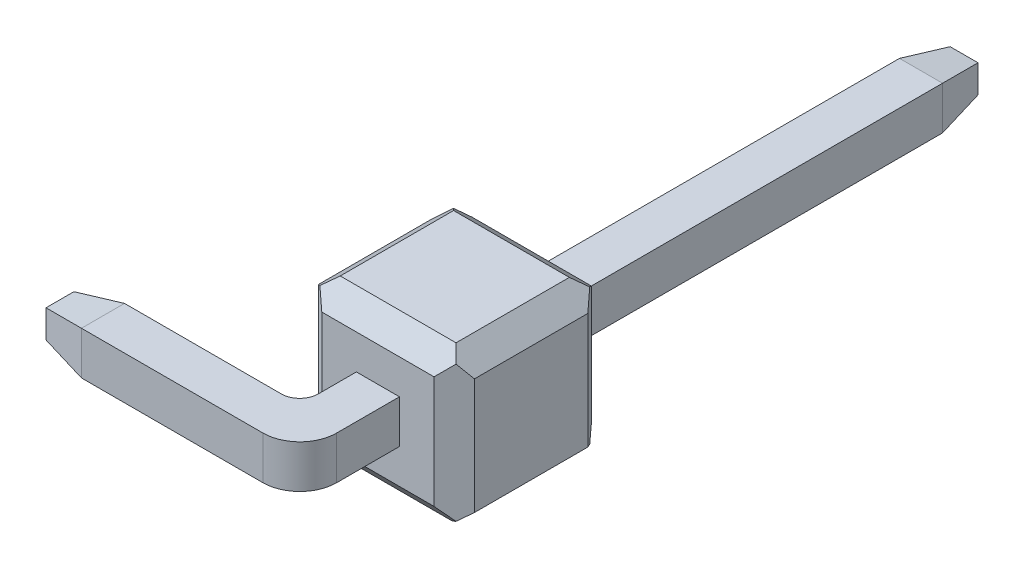
from build123d import *
from OCP.BRepFilletAPI import BRepFilletAPI_MakeChamfer

# Parameters (mm, degrees)
EXTRUDE_1_DEPTH = 0.7
CHAMFER_1_SIZE  = 0.7
CHAMFER_1_SIZE2 = 0.123428886
CHAMFER_2_SIZE  = 0.7
CHAMFER_2_SIZE2 = 0.123428886
SKETCH_2_W      = 2.54
SKETCH_2_H      = 2.54
EXTRUDE_2_DEPTH = 2.5
CHAMFER_3_SIZE  = 0.3
CHAMFER_3_SIZE2 = 0.357526078
CHAMFER_4_SIZE  = 0.3
CHAMFER_4_SIZE2 = 0.357526078
CHAMFER_5_SIZE  = 0.3
CHAMFER_5_SIZE2 = 0.357526078


with BuildPart() as part:
    # Эскиз1 → Бобышка-Вытянуть1 (new body)
    with BuildSketch(Plane(origin=(0, 0, 0), x_dir=(1, 0, 0), z_dir=(0, 1, 0))):
        with BuildLine():
            Line((0.35, 0), (0.35, -10.55))
            ThreePointArc((0.35, -10.55), (0.174264069, -10.974264069), (-0.25, -11.15))
            Line((-0.25, -11.15), (-3.9, -11.15))
            Line((-3.9, -11.15), (-3.9, -10.45))
            Line((-3.9, -10.45), (-0.65, -10.45))
            ThreePointArc((-0.65, -10.45), (-0.437867966, -10.362132034), (-0.35, -10.15))
            Line((-0.35, -10.15), (-0.35, 0))
            Line((-0.35, 0), (0.35, 0))
        make_face()
    extrude(amount=EXTRUDE_1_DEPTH)

    # Фаска1: one chamfer whose edges measure the first distance from different faces: ONE call of the kernel's chamfer builder (chamfer() names one face for all edges)
    chamfer_1_edges_1 = [part.edges().sort_by_distance(p)[0] for p in [
        (0, 0, 0),
    ]]
    chamfer_1_side_1 = [part.faces().sort_by_distance(p)[0] for p in [
        (-0.230674814, 0, 5.075),
    ]]
    chamfer_1_edges_2 = [part.edges().sort_by_distance(p)[0] for p in [
        (0.35, 0.35, 0),
    ]]
    chamfer_1_side_2 = [part.faces().sort_by_distance(p)[0] for p in [
        (0.35, 0.35, 5.275),
    ]]
    chamfer_1_edges_3 = [part.edges().sort_by_distance(p)[0] for p in [
        (-0.35, 0.35, 0),
    ]]
    chamfer_1_side_3 = [part.faces().sort_by_distance(p)[0] for p in [
        (-0.35, 0.35, 5.075),
    ]]
    chamfer_1_edges_4 = [part.edges().sort_by_distance(p)[0] for p in [
        (0, 0.7, 0),
    ]]
    chamfer_1_side_4 = [part.faces().sort_by_distance(p)[0] for p in [
        (-0.230674814, 0.7, 5.075),
    ]]
    chamfer_1 = BRepFilletAPI_MakeChamfer(part.part.solid().wrapped)
    for e in chamfer_1_edges_1:
        chamfer_1.Add(CHAMFER_1_SIZE, CHAMFER_1_SIZE2, e.wrapped, chamfer_1_side_1[0].wrapped)  # the first distance lies on this face
    for e in chamfer_1_edges_2:
        chamfer_1.Add(CHAMFER_1_SIZE, CHAMFER_1_SIZE2, e.wrapped, chamfer_1_side_2[0].wrapped)  # the first distance lies on this face
    for e in chamfer_1_edges_3:
        chamfer_1.Add(CHAMFER_1_SIZE, CHAMFER_1_SIZE2, e.wrapped, chamfer_1_side_3[0].wrapped)  # the first distance lies on this face
    for e in chamfer_1_edges_4:
        chamfer_1.Add(CHAMFER_1_SIZE, CHAMFER_1_SIZE2, e.wrapped, chamfer_1_side_4[0].wrapped)  # the first distance lies on this face
    add(Compound.cast(chamfer_1.Shape()), mode=Mode.REPLACE)

    # Фаска2: one chamfer whose edges measure the first distance from different faces: ONE call of the kernel's chamfer builder (chamfer() names one face for all edges)
    chamfer_2_edges_1 = [part.edges().sort_by_distance(p)[0] for p in [
        (-3.9, 0.35, 11.15),
    ]]
    chamfer_2_side_1 = [part.faces().sort_by_distance(p)[0] for p in [
        (-2.075, 0.35, 11.15),
    ]]
    chamfer_2_edges_2 = [part.edges().sort_by_distance(p)[0] for p in [
        (-3.9, 0.35, 10.45),
    ]]
    chamfer_2_side_2 = [part.faces().sort_by_distance(p)[0] for p in [
        (-2.275, 0.35, 10.45),
    ]]
    chamfer_2_edges_3 = [part.edges().sort_by_distance(p)[0] for p in [
        (-3.9, 0.7, 10.8),
    ]]
    chamfer_2_side_3 = [part.faces().sort_by_distance(p)[0] for p in [
        (-0.23718821, 0.7, 5.425),
    ]]
    chamfer_2_edges_4 = [part.edges().sort_by_distance(p)[0] for p in [
        (-3.9, 0, 10.8),
    ]]
    chamfer_2_side_4 = [part.faces().sort_by_distance(p)[0] for p in [
        (-0.23718821, 0, 5.425),
    ]]
    chamfer_2 = BRepFilletAPI_MakeChamfer(part.part.solid().wrapped)
    for e in chamfer_2_edges_1:
        chamfer_2.Add(CHAMFER_2_SIZE, CHAMFER_2_SIZE2, e.wrapped, chamfer_2_side_1[0].wrapped)  # the first distance lies on this face
    for e in chamfer_2_edges_2:
        chamfer_2.Add(CHAMFER_2_SIZE, CHAMFER_2_SIZE2, e.wrapped, chamfer_2_side_2[0].wrapped)  # the first distance lies on this face
    for e in chamfer_2_edges_3:
        chamfer_2.Add(CHAMFER_2_SIZE, CHAMFER_2_SIZE2, e.wrapped, chamfer_2_side_3[0].wrapped)  # the first distance lies on this face
    for e in chamfer_2_edges_4:
        chamfer_2.Add(CHAMFER_2_SIZE, CHAMFER_2_SIZE2, e.wrapped, chamfer_2_side_4[0].wrapped)  # the first distance lies on this face
    add(Compound.cast(chamfer_2.Shape()), mode=Mode.REPLACE)

    # Эскиз2 → Бобышка-Вытянуть2 (add)
    with BuildSketch(Plane.XY.offset(9.53)):
        with Locations((0, 0.35)):
            Rectangle(SKETCH_2_W, SKETCH_2_H)
    extrude(amount=-EXTRUDE_2_DEPTH)

    # Фаска3
    chamfer_3_edges = [part.edges().sort_by_distance(p)[0] for p in [
        (-1.27, 0.35, 7.03),
        (0, 1.62, 7.03),
        (1.27, 0.35, 7.03),
        (0, -0.92, 7.03),
    ]]
    chamfer_3_side = [part.faces().sort_by_distance(p)[0] for p in [
        (0, -0.884078976, 7.03),
    ]]
    chamfer(chamfer_3_edges, length=CHAMFER_3_SIZE, length2=CHAMFER_3_SIZE2, reference=chamfer_3_side[0])

    # Фаска4: one chamfer whose edges measure the first distance from different faces: ONE call of the kernel's chamfer builder (chamfer() names one face for all edges)
    chamfer_4_edges_1 = [part.edges().sort_by_distance(p)[0] for p in [
        (-1.27, 0.35, 9.53),
    ]]
    chamfer_4_side_1 = [part.faces().sort_by_distance(p)[0] for p in [
        (-1.27, 0.35, 8.458763039),
    ]]
    chamfer_4_edges_2 = [part.edges().sort_by_distance(p)[0] for p in [
        (0, -0.92, 9.53),
    ]]
    chamfer_4_side_2 = [part.faces().sort_by_distance(p)[0] for p in [
        (0, -0.92, 8.458763039),
    ]]
    chamfer_4_edges_3 = [part.edges().sort_by_distance(p)[0] for p in [
        (1.27, 0.35, 9.53),
    ]]
    chamfer_4_side_3 = [part.faces().sort_by_distance(p)[0] for p in [
        (1.27, 0.35, 8.458763039),
    ]]
    chamfer_4_edges_4 = [part.edges().sort_by_distance(p)[0] for p in [
        (0, 1.62, 9.53),
    ]]
    chamfer_4_side_4 = [part.faces().sort_by_distance(p)[0] for p in [
        (0, 1.62, 8.458763039),
    ]]
    chamfer_4 = BRepFilletAPI_MakeChamfer(part.part.solid().wrapped)
    for e in chamfer_4_edges_1:
        chamfer_4.Add(CHAMFER_4_SIZE, CHAMFER_4_SIZE2, e.wrapped, chamfer_4_side_1[0].wrapped)  # the first distance lies on this face
    for e in chamfer_4_edges_2:
        chamfer_4.Add(CHAMFER_4_SIZE, CHAMFER_4_SIZE2, e.wrapped, chamfer_4_side_2[0].wrapped)  # the first distance lies on this face
    for e in chamfer_4_edges_3:
        chamfer_4.Add(CHAMFER_4_SIZE, CHAMFER_4_SIZE2, e.wrapped, chamfer_4_side_3[0].wrapped)  # the first distance lies on this face
    for e in chamfer_4_edges_4:
        chamfer_4.Add(CHAMFER_4_SIZE, CHAMFER_4_SIZE2, e.wrapped, chamfer_4_side_4[0].wrapped)  # the first distance lies on this face
    add(Compound.cast(chamfer_4.Shape()), mode=Mode.REPLACE)

    # Фаска5: one chamfer whose edges measure the first distance from different faces: ONE call of the kernel's chamfer builder (chamfer() names one face for all edges)
    chamfer_5_edges_1 = [part.edges().sort_by_distance(p)[0] for p in [
        (-1.27, -0.92, 8.308763039),
    ]]
    chamfer_5_side_1 = [part.faces().sort_by_distance(p)[0] for p in [
        (0, -0.92, 8.308763039),
    ]]
    chamfer_5_edges_2 = [part.edges().sort_by_distance(p)[0] for p in [
        (1.27, -0.92, 8.308763039),
    ]]
    chamfer_5_side_2 = [part.faces().sort_by_distance(p)[0] for p in [
        (1.27, 0.35, 8.308763039),
    ]]
    chamfer_5_edges_3 = [part.edges().sort_by_distance(p)[0] for p in [
        (-1.27, 1.62, 8.308763039),
    ]]
    chamfer_5_side_3 = [part.faces().sort_by_distance(p)[0] for p in [
        (-1.27, 0.35, 8.308763039),
    ]]
    chamfer_5_edges_4 = [part.edges().sort_by_distance(p)[0] for p in [
        (1.27, 1.62, 8.308763039),
    ]]
    chamfer_5_side_4 = [part.faces().sort_by_distance(p)[0] for p in [
        (0, 1.62, 8.308763039),
    ]]
    chamfer_5 = BRepFilletAPI_MakeChamfer(part.part.solid().wrapped)
    for e in chamfer_5_edges_1:
        chamfer_5.Add(CHAMFER_5_SIZE, CHAMFER_5_SIZE2, e.wrapped, chamfer_5_side_1[0].wrapped)  # the first distance lies on this face
    for e in chamfer_5_edges_2:
        chamfer_5.Add(CHAMFER_5_SIZE, CHAMFER_5_SIZE2, e.wrapped, chamfer_5_side_2[0].wrapped)  # the first distance lies on this face
    for e in chamfer_5_edges_3:
        chamfer_5.Add(CHAMFER_5_SIZE, CHAMFER_5_SIZE2, e.wrapped, chamfer_5_side_3[0].wrapped)  # the first distance lies on this face
    for e in chamfer_5_edges_4:
        chamfer_5.Add(CHAMFER_5_SIZE, CHAMFER_5_SIZE2, e.wrapped, chamfer_5_side_4[0].wrapped)  # the first distance lies on this face
    add(Compound.cast(chamfer_5.Shape()), mode=Mode.REPLACE)


solid = part.part
